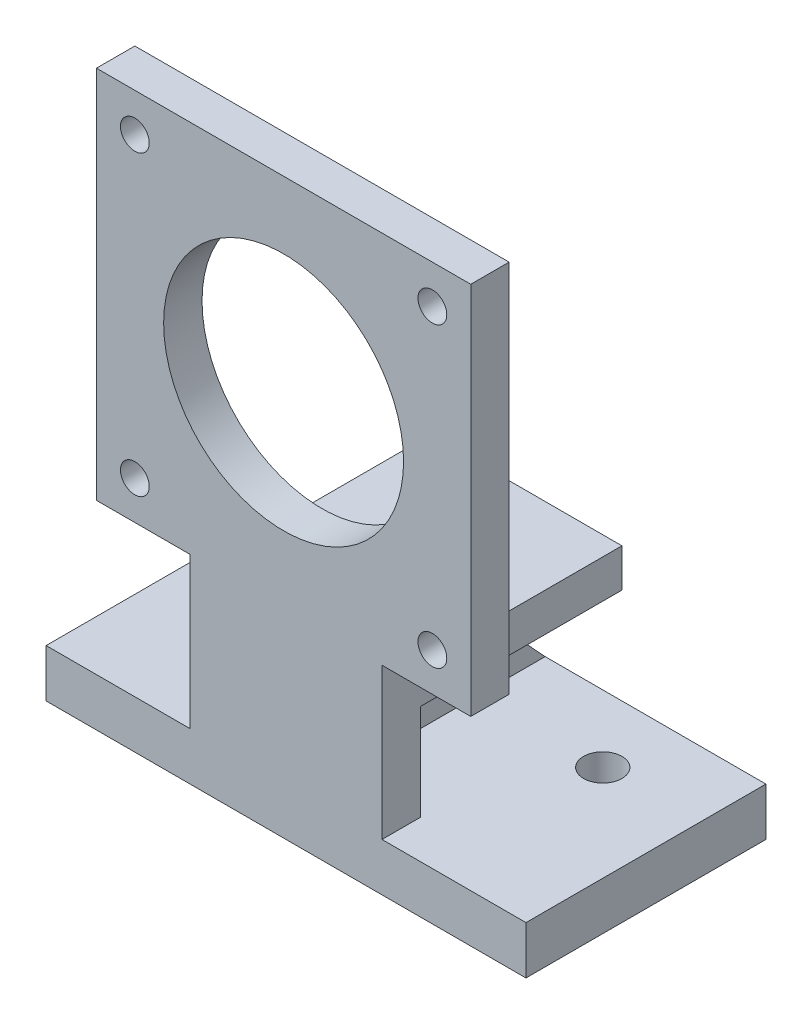
from build123d import *

# Parameters (mm, degrees)
SKETCH1_R                = 1.5
SKETCH1_R_2              = 12.5
BOSS_EXTRUDE1_DEPTH      = 4
SKETCH2_W                = 50
SKETCH2_H                = 25
SKETCH2_R                = 2
BOSS_EXTRUDE2_DEPTH      = 5
BOSS_EXTRUDE3_DEPTH      = 2
BOSS_EXTRUDE3_DEPTH_BACK = 2
SKETCH6_W                = 42
SKETCH6_H                = 42
CUT_EXTRUDE1_DEPTH       = 52.633322574
SKETCH6_3_W              = 20
SKETCH6_3_H              = 4
BOSS_EXTRUDE4_DEPTH      = 21


with BuildPart() as part:
    # Sketch1 → Boss-Extrude1 (new body)
    with BuildSketch(Plane.XY):
        Polygon((19.247712685, -19.276828776), (19.247712685, 19.723171224), (-19.752287315, 19.723171224), (-19.752287315, -19.276828776), (-10, -19.276828776), (-10, -40), (10, -40), (10, -19.276828776), align=None)
        with Locations((-15.752287315, 15.723171224)):
            Circle(SKETCH1_R, mode=Mode.SUBTRACT)
        with Locations((-15.752287315, -15.276828776)):
            Circle(SKETCH1_R, mode=Mode.SUBTRACT)
        with Locations((-0.252287315, 0.223171224)):
            Circle(SKETCH1_R_2, mode=Mode.SUBTRACT)
        with Locations((15.247712685, -15.276828776)):
            Circle(SKETCH1_R, mode=Mode.SUBTRACT)
        with Locations((15.247712685, 15.723171224)):
            Circle(SKETCH1_R, mode=Mode.SUBTRACT)
    extrude(amount=BOSS_EXTRUDE1_DEPTH)

    # Sketch2 → Boss-Extrude2 (add)
    with BuildSketch(Plane.XZ.offset(40)):
        with Locations((0, -8.5)):
            Rectangle(SKETCH2_W, SKETCH2_H)
        with Locations((-15, -14)):
            Circle(SKETCH2_R, mode=Mode.SUBTRACT)
        with Locations((15, -14)):
            Circle(SKETCH2_R, mode=Mode.SUBTRACT)
    extrude(amount=-BOSS_EXTRUDE2_DEPTH)

    # Sketch5 → Boss-Extrude3 (add, two sides: drawn at the far end of the back side and taken through both)
    with BuildSketch(Plane(origin=(0, 0, 0), x_dir=(0, 0, -1), z_dir=(1, 0, 0)).offset(-BOSS_EXTRUDE3_DEPTH_BACK)):
        Polygon((21, -35), (0, -12.250562953), (0, -35), align=None)
    extrude(amount=BOSS_EXTRUDE3_DEPTH + BOSS_EXTRUDE3_DEPTH_BACK)

    # Sketch6 → Cut-Extrude1 (cut, through all)
    with BuildSketch(Plane(origin=(0, 0, 0), x_dir=(-1, 0, 0), z_dir=(0, 0, -1))):
        Rectangle(SKETCH6_W, SKETCH6_H)
    extrude(amount=CUT_EXTRUDE1_DEPTH, mode=Mode.SUBTRACT)

    # Sketch6<3> → Boss-Extrude4 (add, through all)
    with BuildSketch(Plane(origin=(0, 0, 0), x_dir=(-1, 0, 0), z_dir=(0, 0, -1))):
        with Locations((0, -23)):
            Rectangle(SKETCH6_3_W, SKETCH6_3_H)
    extrude(amount=BOSS_EXTRUDE4_DEPTH)


solid = part.part
